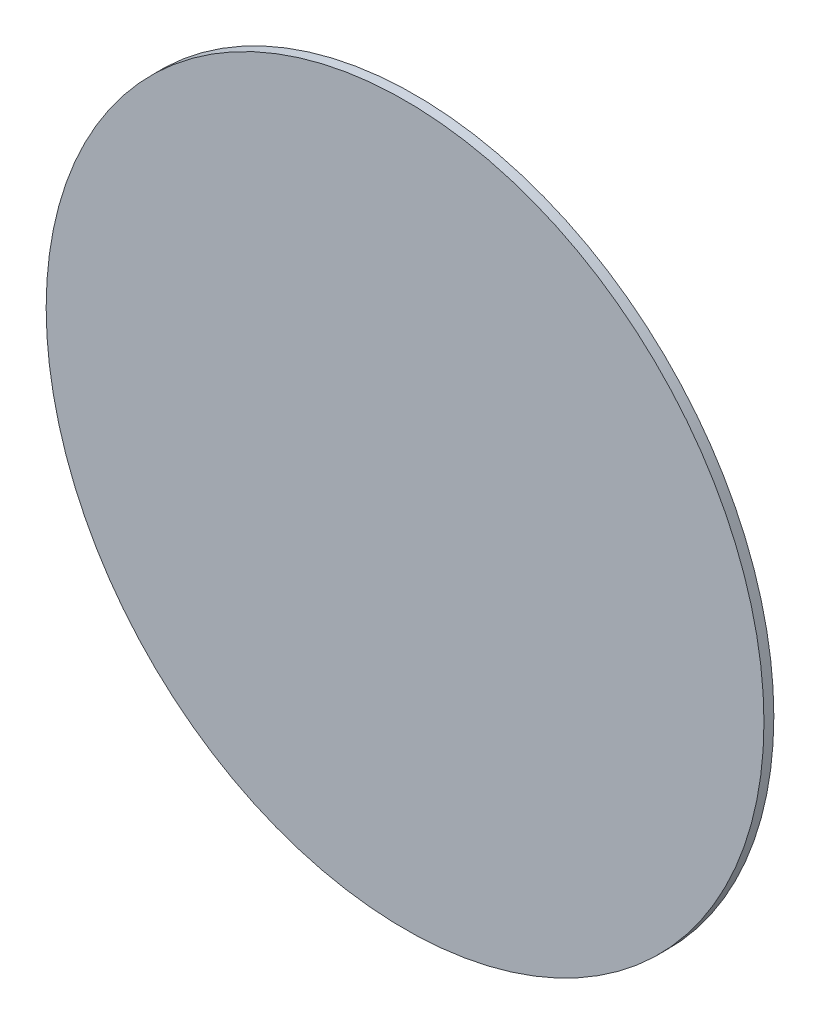
from build123d import *

# Parameters (mm, degrees)
ESQUISSE1_R        = 109
BOSS_EXTRU_1_DEPTH = 3


with BuildPart() as part:
    # Esquisse1 → Boss.-Extru.1 (new body)
    with BuildSketch(Plane.XY):
        Circle(ESQUISSE1_R)
    extrude(amount=BOSS_EXTRU_1_DEPTH)


solid = part.part
